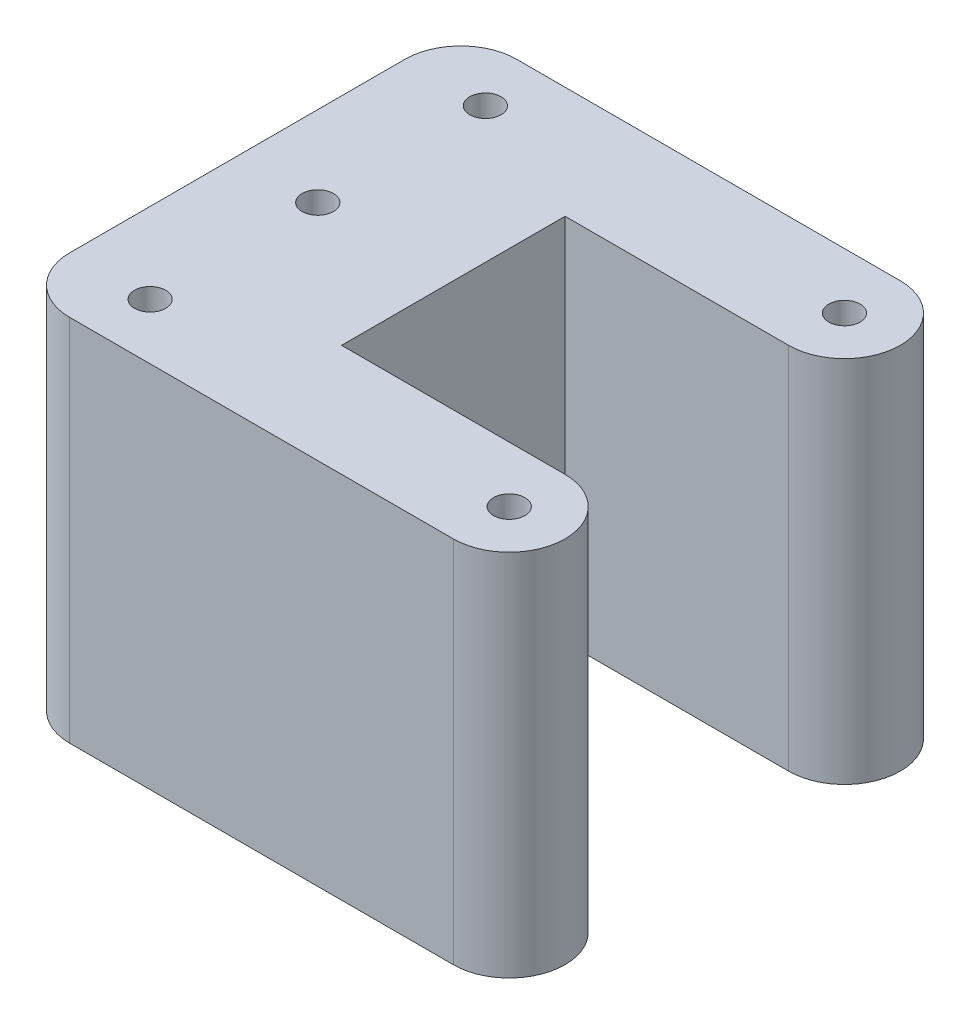
from build123d import *

# Parameters (mm, degrees)
SKETCH_1_R      = 1.4
EXTRUDE_1_DEPTH = 33


with BuildPart() as part:
    # 草图1 → 凸台-拉伸1 (new body)
    with BuildSketch(Plane(origin=(0, 0, 0), x_dir=(1, 0, 0), z_dir=(0, 1, 0))):
        with BuildLine():
            Line((63.539198291, -45.541591726), (63.539198291, -25.541591726))
            Line((63.539198291, -25.541591726), (83.539198291, -25.541591726))
            ThreePointArc((83.539198291, -25.541591726), (88.539198291, -20.541591726), (83.539198291, -15.541591726))
            Line((83.539198291, -15.541591726), (49.205502665, -15.541591726))
            ThreePointArc((49.205502665, -15.541591726), (45.669968759, -17.006057821), (44.205502665, -20.541591726))
            Line((44.205502665, -20.541591726), (44.205502665, -50.541591726))
            ThreePointArc((44.205502665, -50.541591726), (45.669968759, -54.077125632), (49.205502665, -55.541591726))
            Line((49.205502665, -55.541591726), (83.539198291, -55.541591726))
            ThreePointArc((83.539198291, -55.541591726), (88.539198291, -50.541591726), (83.539198291, -45.541591726))
            Line((83.539198291, -45.541591726), (63.539198291, -45.541591726))
        make_face()
        with Locations(Location((83.539198291, -20.541591726, 0), (0, 0, 270))):
            Circle(SKETCH_1_R, mode=Mode.SUBTRACT)
        with Locations(Location((83.539198291, -50.541591726, 0), (0, 0, 90))):
            Circle(SKETCH_1_R, mode=Mode.SUBTRACT)
        with Locations(Location((51.406078432, -20.541591726, 0), (0, 0, 270))):
            Circle(SKETCH_1_R, mode=Mode.SUBTRACT)
        with Locations(Location((51.406078432, -35.541591726, 0), (0, 0, 270))):
            Circle(SKETCH_1_R, mode=Mode.SUBTRACT)
        with Locations(Location((51.406078432, -50.541591726, 0), (0, 0, 90))):
            Circle(SKETCH_1_R, mode=Mode.SUBTRACT)
    extrude(amount=EXTRUDE_1_DEPTH)


solid = part.part
